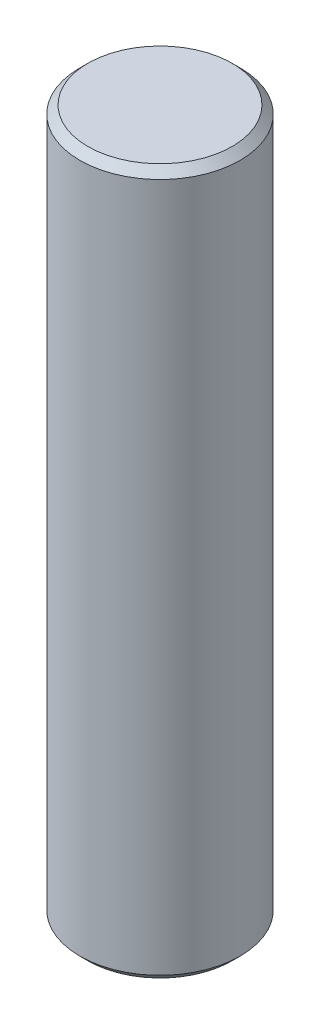
from build123d import *

# Parameters (mm, degrees)
SKETCH1_R           = 2.5
BOSS_EXTRUDE1_DEPTH = 11
CHAMFER1_SIZE       = 0.25


with BuildPart() as part:
    # Sketch1 → Boss-Extrude1 (new, symmetric)
    with BuildSketch(Plane(origin=(0, 0, 0), x_dir=(1, 0, 0), z_dir=(0, 1, 0))):
        with Locations(Location((0, 0, 0), (0, 0, 270))):
            Circle(SKETCH1_R)
    extrude(amount=BOSS_EXTRUDE1_DEPTH, both=True)

    # Chamfer1
    chamfer1_edges = [part.edges().sort_by_distance(p)[0] for p in [
        (0, -11, -2.5),
        (0, 11, -2.5),
    ]]
    chamfer(chamfer1_edges, length=CHAMFER1_SIZE)


solid = part.part
